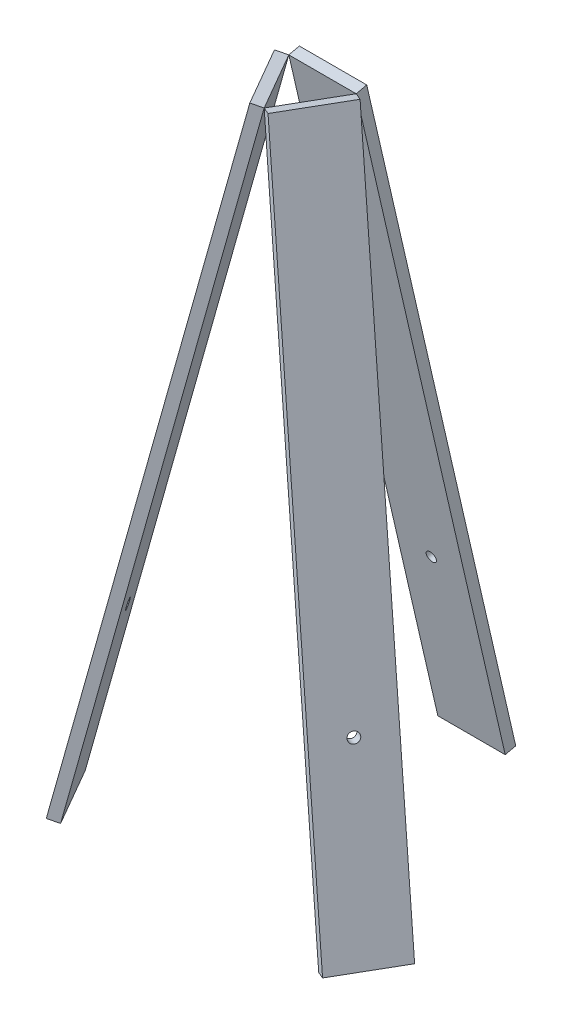
from build123d import *

# Parameters (mm, degrees)
SKETCH_4_W               = 10
SKETCH_4_H               = 98.513936913
EXTRUDE_1_DEPTH          = 1.6
SKETCH_5_R               = 0.75
CUT_EXTRUDE_1_DEPTH      = 104.118352348
PATTERN_CIRCULAR_3_COUNT = 3


with BuildPart() as part:
    # 草图4 → 凸台-拉伸1 (new body)
    with BuildSketch(Plane(origin=(0, 5.97236267, -25.927751518), x_dir=(1, 0, 0), z_dir=(0, -0.22446822598970886, 0.9744814085045609))):
        with Locations((0, 53.390076892)):
            Rectangle(SKETCH_4_W, SKETCH_4_H)
    extrude(amount=-EXTRUDE_1_DEPTH)

    # 草图5 → 切除-拉伸1 (cut, through all)
    with BuildSketch(Plane(origin=(0, 5.97236267, -25.927751518), x_dir=(1, 0, 0), z_dir=(0, -0.22446822598970892, 0.9744814085045609))):
        with Locations((0, 30.721954777)):
            Circle(SKETCH_5_R)
    extrude(amount=-CUT_EXTRUDE_1_DEPTH, mode=Mode.SUBTRACT)


with BuildPart() as pattern_circular_3_1:
    # 阵列(圆周)3: pattern copy
    add(part.part.rotate(Axis((0, 108.058043324, 0), (0, -1, 0)), 1 * 360 / PATTERN_CIRCULAR_3_COUNT))


with BuildPart() as pattern_circular_3_2:
    # 阵列(圆周)3: pattern copy
    add(part.part.rotate(Axis((0, 108.058043324, 0), (0, -1, 0)), 2 * 360 / PATTERN_CIRCULAR_3_COUNT))


solid = Compound([part.part, pattern_circular_3_1.part, pattern_circular_3_2.part])
